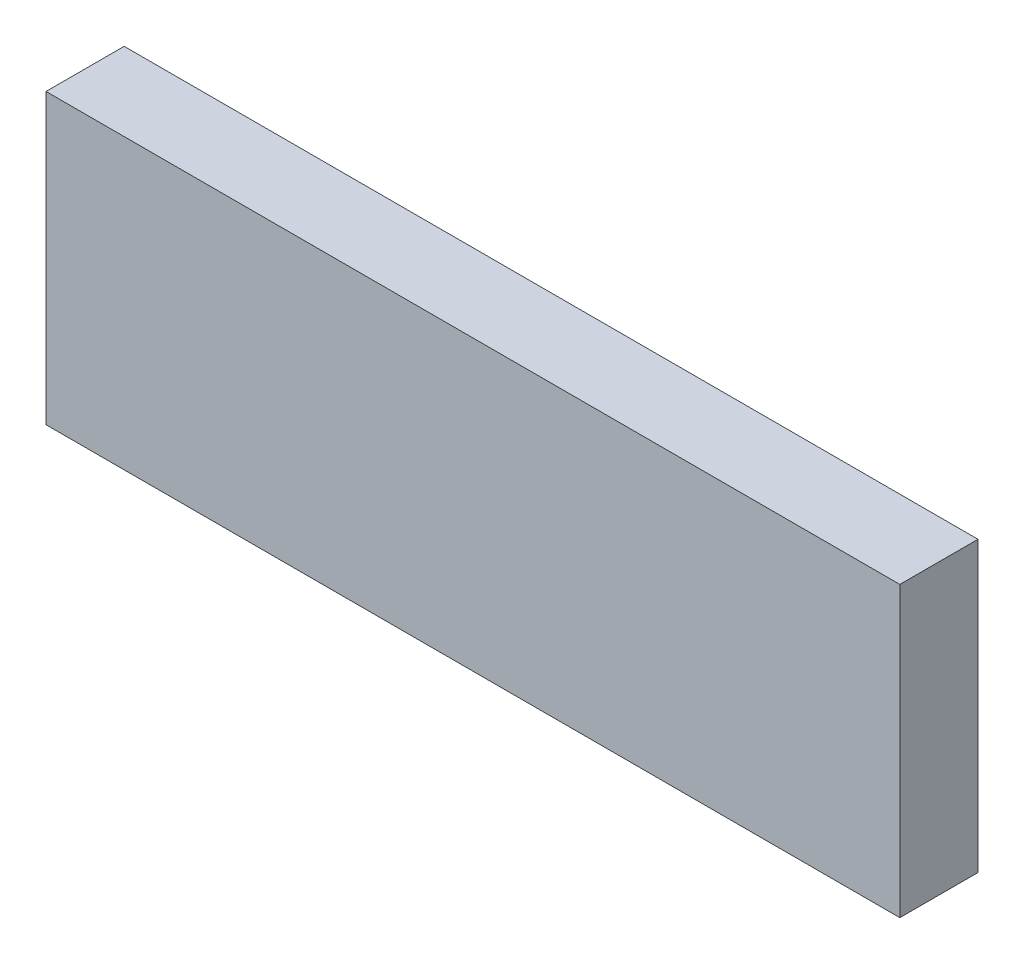
from build123d import *

# Parameters (mm, degrees)
SKETCH1_W           = 142
SKETCH1_H           = 48
BOSS_EXTRUDE1_DEPTH = 13


with BuildPart() as part:
    # Sketch1 → Boss-Extrude1 (new body)
    with BuildSketch(Plane.XY):
        with Locations((71, 24)):
            Rectangle(SKETCH1_W, SKETCH1_H)
    extrude(amount=BOSS_EXTRUDE1_DEPTH)


solid = part.part
